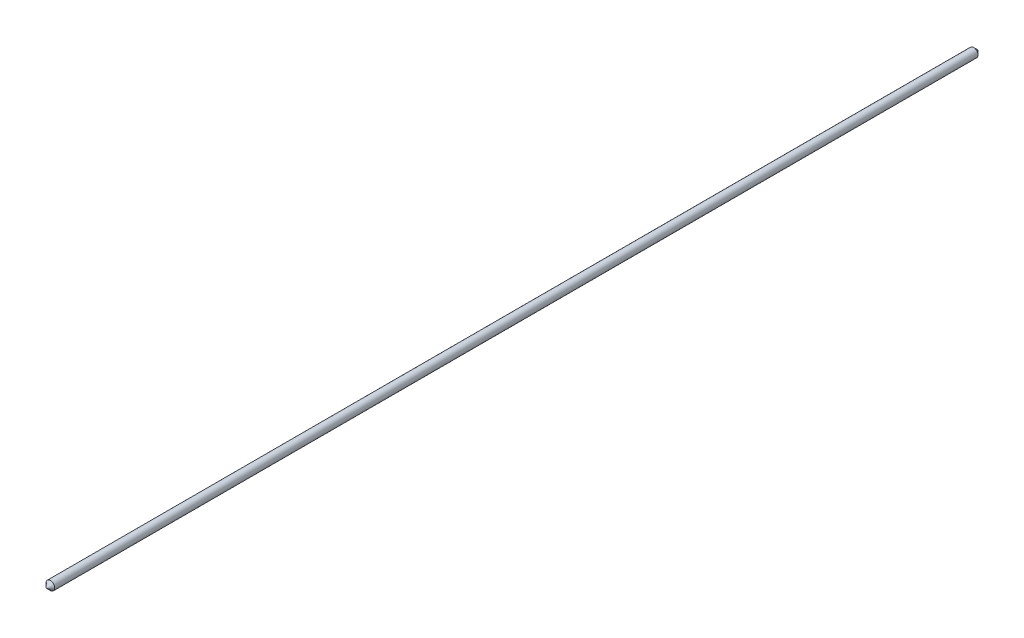
from build123d import *


with BuildPart() as part:
    # Sketch1 → Revolve1 (revolve)
    with BuildSketch(Plane(origin=(0, 0, 0), x_dir=(0, 0, -1), z_dir=(1, 0, 0)), mode=Mode.PRIVATE) as revolve1_sk:
        Polygon((-52.735251665, 0), (-42.339851199, 10.395400466), (2157.660148801, 10.395400466), (2168.055549267, 0), (2057.660148801, 0), (-42.339851199, 0), align=None)
    revolve(revolve1_sk.sketch.rotate(Axis((0, 0, 42.339851199), (0, 0, -1)), 90), axis=Axis((0, 0, 42.339851199), (0, 0, -1)))


solid = part.part
